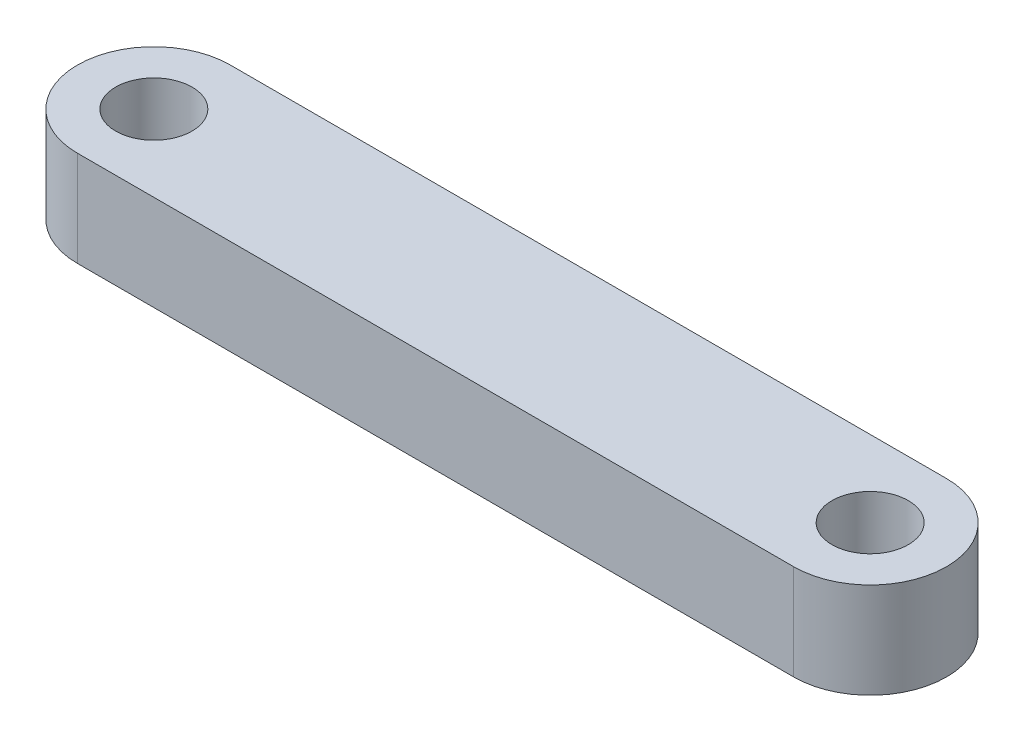
from build123d import *

# Parameters (mm, degrees)
SKETCH1_R           = 4
BOSS_EXTRUDE1_DEPTH = 10


with BuildPart() as part:
    # Sketch1 → Boss-Extrude1 (new body)
    with BuildSketch(Plane(origin=(0, 0, 0), x_dir=(1, 0, 0), z_dir=(0, 1, 0))):
        with BuildLine():
            Line((-130, 0), (-55, 0))
            ThreePointArc((-55, 0), (-47, -8), (-55, -16))
            Line((-55, -16), (-130, -16))
            ThreePointArc((-130, -16), (-138, -8), (-130, 0))
        make_face()
        with Locations(Location((-130, -8, 0), (0, 0, 270))):
            Circle(SKETCH1_R, mode=Mode.SUBTRACT)
        with Locations(Location((-55, -8, 0), (0, 0, 270))):
            Circle(SKETCH1_R, mode=Mode.SUBTRACT)
    extrude(amount=BOSS_EXTRUDE1_DEPTH)


solid = part.part
